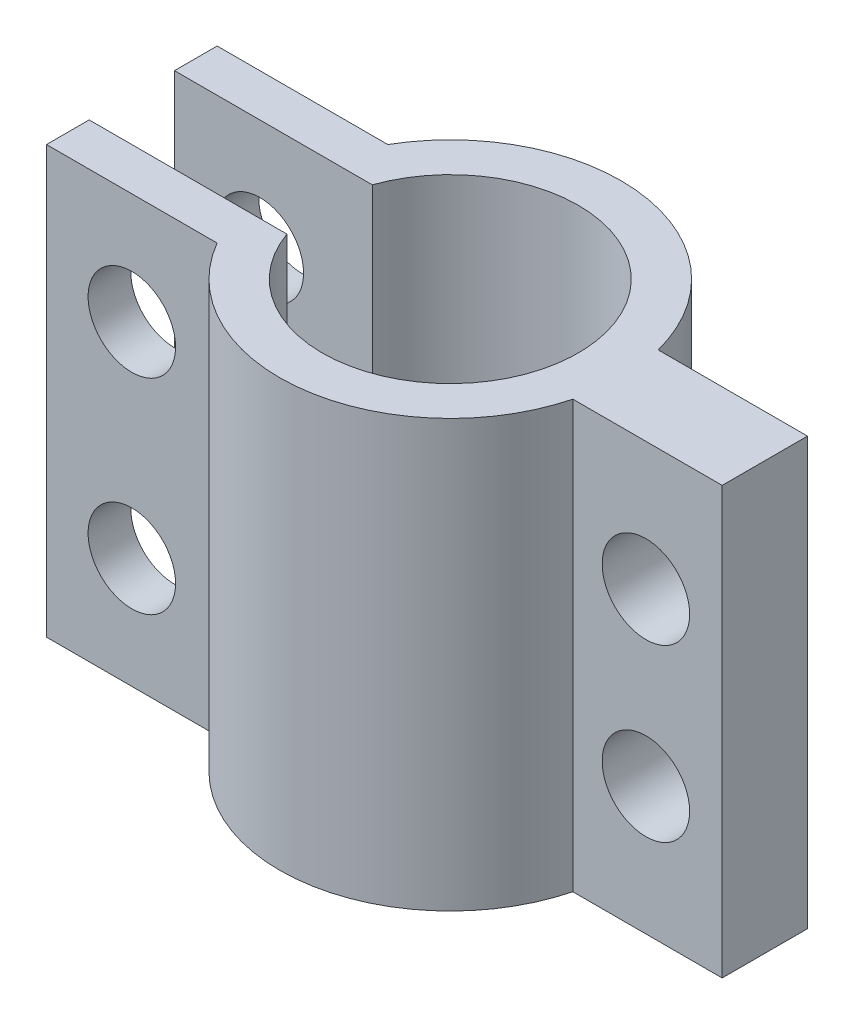
from build123d import *

# Parameters (mm, degrees)
BOSS_EXTRUDE1_DEPTH = 20
SKETCH2_R           = 2.05
CUT_EXTRUDE1_DEPTH  = 20


with BuildPart() as part:
    # Sketch1 → Boss-Extrude1 (new body)
    with BuildSketch(Plane(origin=(0, 0, 0), x_dir=(1, 0, 0), z_dir=(0, 1, 0))):
        with BuildLine():
            Line((-14.92820323, 2), (-5.656854249, 2))
            ThreePointArc((-5.656854249, 2), (6, 0), (-5.656854249, -2))
            Line((-5.656854249, -2), (-14.92820323, -2))
            Line((-14.92820323, -2), (-14.92820323, -4))
            Line((-14.92820323, -4), (-6.92820323, -4))
            ThreePointArc((-6.92820323, -4), (1.080363027, -7.926715318), (7.745966692, -2))
            Line((7.745966692, -2), (14.745966692, -2))
            Line((14.745966692, -2), (14.745966692, 2))
            Line((14.745966692, 2), (7.745966692, 2))
            ThreePointArc((7.745966692, 2), (1.080363027, 7.926715318), (-6.92820323, 4))
            Line((-6.92820323, 4), (-14.92820323, 4))
            Line((-14.92820323, 4), (-14.92820323, 2))
        make_face()
    extrude(amount=BOSS_EXTRUDE1_DEPTH)

    # Sketch2 → Cut-Extrude1 (cut)
    with BuildSketch(Plane.XY.offset(4)):
        with Locations((-10.92820323, 14.8)):
            Circle(SKETCH2_R)
        with Locations((-10.92820323, 5.2)):
            Circle(SKETCH2_R)
        with Locations((11.170658207, 14)):
            Circle(SKETCH2_R)
        with Locations((11.170658207, 6)):
            Circle(SKETCH2_R)
    extrude(amount=-CUT_EXTRUDE1_DEPTH, mode=Mode.SUBTRACT)


solid = part.part
